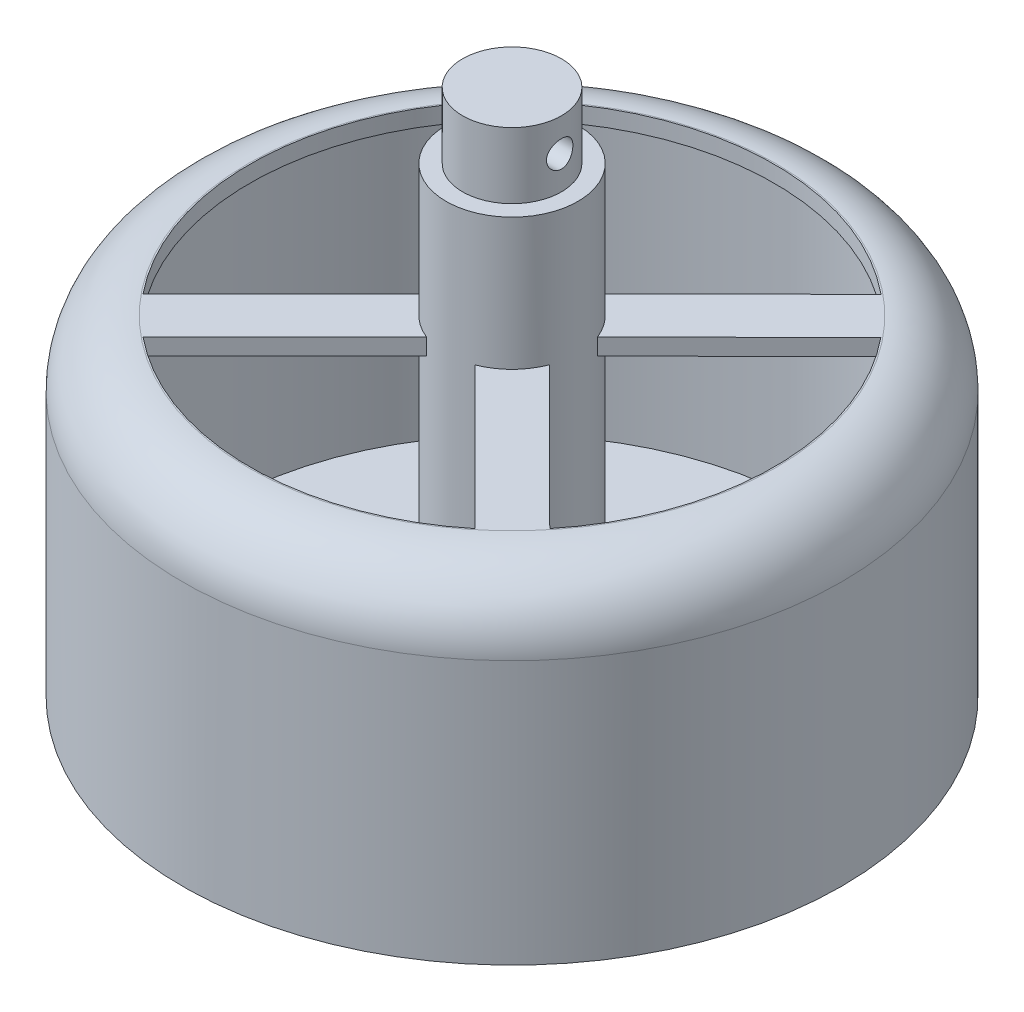
from build123d import *
from build123d.topology import SkipClean

# Parameters (mm, degrees)
SKETCH2_R               = 10
BOSS_EXTRUDE1_DEPTH     = 30
CUT_EXTRUDE1_START      = -10
SKETCH3_R               = 10
SKETCH3_R_2             = 7.5
CUT_EXTRUDE1_DEPTH      = 10
CUT_EXTRUDE3_DEPTH      = 10
CUT_EXTRUDE3_DEPTH_BACK = 10
SKETCH5_R               = 2
CUT_EXTRUDE4_START      = -10
CUT_EXTRUDE4_DEPTH      = 10
FILLET2_R               = 10
BOSS_EXTRUDE2_START     = -67.5
SKETCH7_R               = 10
BOSS_EXTRUDE2_DEPTH     = 67.5


with BuildPart() as part:
    # Sketch1 → Revolve1 (revolve)
    with BuildSketch(Plane.XY):
        Polygon((50, 25), (0, 25), (0, 22.5), (45, 22.5), (45, -22.5), (0, -22.5), (0, -25), (50, -25), align=None)
    revolve(axis=Axis((0, -25, 0), (0, 1, 0)))

    # Sketch2 → Boss-Extrude1 (add)
    with BuildSketch(Plane(origin=(0, 25, 0), x_dir=(1, 0, 0), z_dir=(0, 1, 0))):
        with Locations(Location((0, 0, 0), (0, 0, 180))):
            Circle(SKETCH2_R)
    extrude(amount=BOSS_EXTRUDE1_DEPTH)

    # Sketch3 → Cut-Extrude1 (cut)
    with BuildSketch(Plane(origin=(0, 55, 0), x_dir=(1, 0, 0), z_dir=(0, 1, 0)).offset(CUT_EXTRUDE1_START)):
        with Locations(Location((0, 0, 0), (0, 0, 180))):
            Circle(SKETCH3_R)
        with Locations(Location((0, 0, 0), (0, 0, 180))):
            Circle(SKETCH3_R_2, mode=Mode.SUBTRACT)
    extrude(amount=CUT_EXTRUDE1_DEPTH, mode=Mode.SUBTRACT)

    # Sketch5 → Cut-Extrude3 (cut, two sides: drawn at the far end of the back side and taken through both)
    with BuildSketch(Plane(origin=(0, 0, 0), x_dir=(0, 0, -1), z_dir=(1, 0, 0)).offset(-CUT_EXTRUDE3_DEPTH_BACK)):
        with Locations(Location((0, 50, 0), (0, 0, 180))):
            Circle(SKETCH5_R)
    extrude(amount=CUT_EXTRUDE3_DEPTH + CUT_EXTRUDE3_DEPTH_BACK, mode=Mode.SUBTRACT)

    # Sketch6 → Cut-Extrude4 (cut)
    with SkipClean():  # the faces are left unmerged after this step: merging them gives an invalid solid
        with BuildSketch(Plane(origin=(0, 25, 0), x_dir=(1, 0, 0), z_dir=(0, 1, 0)).offset(CUT_EXTRUDE4_START)):
            with BuildLine():
                ThreePointArc((18.327704801, 35.312767957), (0, 39.785629869), (-18.327704801, 35.312767957))
                Line((-18.327704801, 35.312767957), (18.327704801, 35.312767957))
            make_face()
            with BuildLine():
                Line((-25.198784951, 30.788270186), (-3.663513289, 9.304766004))
                ThreePointArc((-3.663513289, 9.304766004), (0, 10), (3.663513289, 9.304766004))
                Line((3.663513289, 9.304766004), (25.198784951, 30.788270186))
                ThreePointArc((25.198784951, 30.788270186), (21.880507251, 33.228598323), (18.327704801, 35.312767957))
                Line((18.327704801, 35.312767957), (-18.327704801, 35.312767957))
                ThreePointArc((-18.327704801, 35.312767957), (-21.880507251, 33.228598323), (-25.198784951, 30.788270186))
            make_face()
            with BuildLine():
                Line((30.848827824, 25.124612751), (9.313556162, 3.641108569))
                ThreePointArc((9.313556162, 3.641108569), (9.826890699, 1.852624946), (10, 0))
                ThreePointArc((10, 0), (9.826890699, -1.852624946), (9.313556162, -3.641108569))
                Line((9.313556162, -3.641108569), (30.848827824, -25.124612751))
                ThreePointArc((30.848827824, -25.124612751), (33.305743158, -21.762900008), (35.397858964, -18.162817094))
                Line((35.397858964, -18.162817094), (35.397858964, 18.162817094))
                ThreePointArc((35.397858964, 18.162817094), (33.305743158, 21.762900008), (30.848827824, 25.124612751))
            make_face()
            with BuildLine():
                ThreePointArc((39.785629869, 0), (38.673133173, 9.342650297), (35.397858964, 18.162817094))
                Line((35.397858964, 18.162817094), (35.397858964, -18.162817094))
                ThreePointArc((35.397858964, -18.162817094), (38.673133173, -9.342650297), (39.785629869, 0))
            make_face()
            with BuildLine():
                ThreePointArc((3.663513289, -9.304766004), (0, -10), (-3.663513289, -9.304766004))
                Line((-3.663513289, -9.304766004), (-25.198784951, -30.788270186))
                ThreePointArc((-25.198784951, -30.788270186), (-21.880507251, -33.228598323), (-18.327704801, -35.312767957))
                Line((-18.327704801, -35.312767957), (18.327704801, -35.312767957))
                ThreePointArc((18.327704801, -35.312767957), (21.880507251, -33.228598323), (25.198784951, -30.788270186))
                Line((25.198784951, -30.788270186), (3.663513289, -9.304766004))
            make_face()
            with BuildLine():
                Line((18.327704801, -35.312767957), (-18.327704801, -35.312767957))
                ThreePointArc((-18.327704801, -35.312767957), (0, -39.785629869), (18.327704801, -35.312767957))
            make_face()
            with BuildLine():
                ThreePointArc((-9.313556162, -3.641108569), (-10, 0), (-9.313556162, 3.641108569))
                Line((-9.313556162, 3.641108569), (-30.848827824, 25.124612751))
                ThreePointArc((-30.848827824, 25.124612751), (-33.305743158, 21.762900008), (-35.397858964, 18.162817094))
                Line((-35.397858964, 18.162817094), (-35.397858964, -18.162817094))
                ThreePointArc((-35.397858964, -18.162817094), (-33.305743158, -21.762900008), (-30.848827824, -25.124612751))
                Line((-30.848827824, -25.124612751), (-9.313556162, -3.641108569))
            make_face()
            with BuildLine():
                Line((-35.397858964, -18.162817094), (-35.397858964, 18.162817094))
                ThreePointArc((-35.397858964, 18.162817094), (-39.785629869, 0), (-35.397858964, -18.162817094))
            make_face()
        extrude(amount=CUT_EXTRUDE4_DEPTH, mode=Mode.SUBTRACT)

    # Fillet2
    fillet2_edges = [part.edges().sort_by_distance(p)[0] for p in [
        (-50, 25, 0),
    ]]
    fillet(fillet2_edges, radius=FILLET2_R)

    # Sketch7 → Boss-Extrude2 (add)
    with SkipClean():  # the faces are left unmerged after this step: merging them gives an invalid solid
        with BuildSketch(Plane(origin=(0, 45, 0), x_dir=(1, 0, 0), z_dir=(0, 1, 0)).offset(BOSS_EXTRUDE2_START)):
            with Locations(Location((0, 0, 0), (0, 0, 180))):
                Circle(SKETCH7_R)
        extrude(amount=BOSS_EXTRUDE2_DEPTH)


solid = part.part
